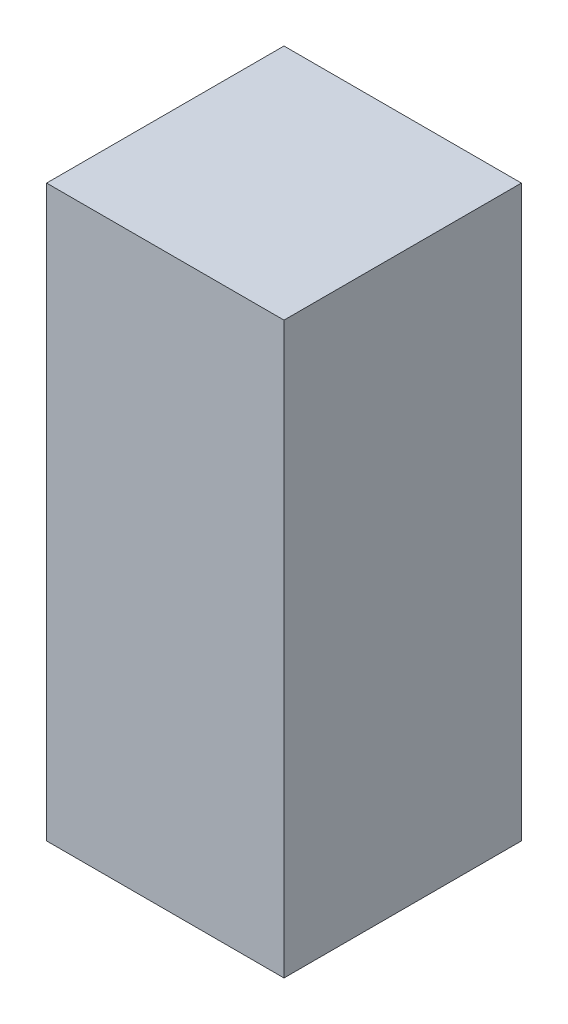
from build123d import *

# Parameters (mm, degrees)
CROQUIS1_W              = 5
CROQUIS1_H              = 5
SALIENTE_EXTRUIR1_DEPTH = 6


with BuildPart() as part:
    # Croquis1 → Saliente-Extruir1 (new, symmetric)
    with BuildSketch(Plane(origin=(0, 0, 0), x_dir=(1, 0, 0), z_dir=(0, 1, 0))):
        Rectangle(CROQUIS1_W, CROQUIS1_H)
    extrude(amount=SALIENTE_EXTRUIR1_DEPTH, both=True)


solid = part.part
